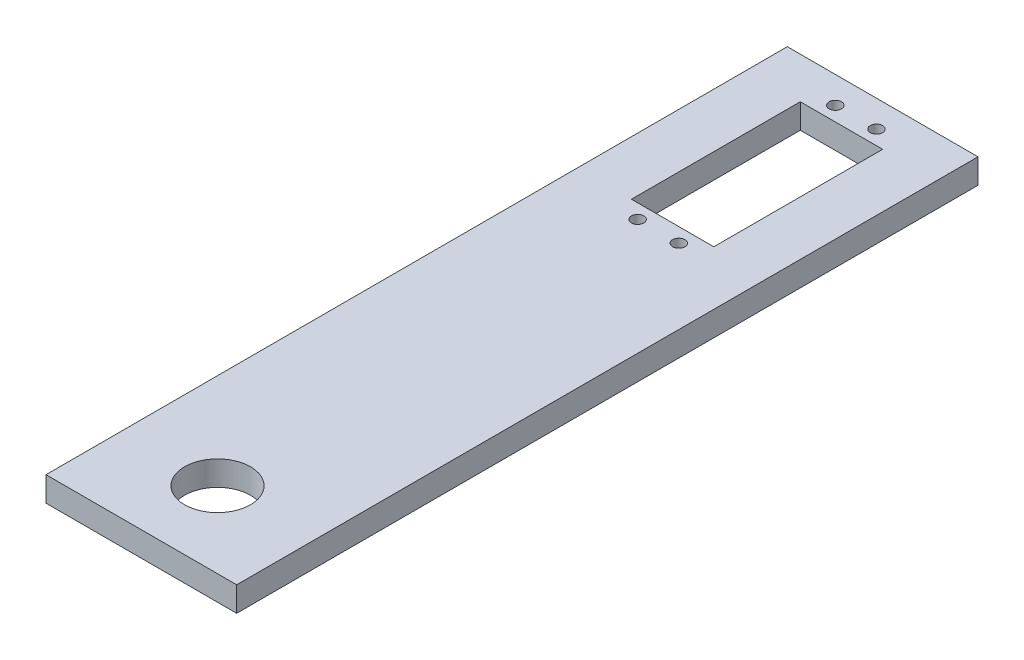
from build123d import *

# Parameters (mm, degrees)
SKETCH1_W           = 46.3
SKETCH1_H           = 180
BOSS_EXTRUDE1_DEPTH = 6
CUT_EXTRUDE1_REACH  = 187.956
SKETCH2_R           = 8
CUT_EXTRUDE2_REACH  = 187.956
SKETCH4_R           = 1.5
SKETCH4_W           = 20
SKETCH4_H           = 41


with BuildPart() as part:
    # Sketch1 → Boss-Extrude1 (new body)
    with BuildSketch(Plane(origin=(0, 0, 0), x_dir=(1, 0, 0), z_dir=(0, 1, 0))):
        with Locations((23.15, 90)):
            Rectangle(SKETCH1_W, SKETCH1_H)
    extrude(amount=BOSS_EXTRUDE1_DEPTH)

    # Sketch2 → Cut-Extrude1 (cut, up to next)
    with BuildSketch(Plane(origin=(0, 6, 0), x_dir=(1, 0, 0), z_dir=(0, 1, 0)), mode=Mode.PRIVATE) as cut_extrude1_sk1:
        with Locations(Location((23.15, 18.5, 0), (0, 0, 270))):
            Circle(SKETCH2_R)
    cut_extrude1_tool1 = extrude(cut_extrude1_sk1.sketch, amount=-CUT_EXTRUDE1_REACH, mode=Mode.PRIVATE) & part.part
    add(cut_extrude1_tool1.solids().sort_by_distance((23.15, 6, -18.5))[0], mode=Mode.SUBTRACT)

    # Sketch4 → Cut-Extrude2 (cut, up to next)
    with BuildSketch(Plane.XZ, mode=Mode.PRIVATE) as cut_extrude2_sk1:
        with Locations(Location((28.15, -173.5, 0), (0, 0, 270))):
            Circle(SKETCH4_R)
    cut_extrude2_tool1 = extrude(cut_extrude2_sk1.sketch, amount=-CUT_EXTRUDE2_REACH, mode=Mode.PRIVATE) & part.part
    # Sketch4 → Cut-Extrude2 (cut, up to next)
    with BuildSketch(Plane.XZ, mode=Mode.PRIVATE) as cut_extrude2_sk2:
        with Locations(Location((18.15, -173.5, 0), (0, 0, 270))):
            Circle(SKETCH4_R)
    cut_extrude2_tool2 = extrude(cut_extrude2_sk2.sketch, amount=-CUT_EXTRUDE2_REACH, mode=Mode.PRIVATE) & part.part
    # Sketch4 → Cut-Extrude2 (cut, up to next)
    with BuildSketch(Plane.XZ, mode=Mode.PRIVATE) as cut_extrude2_sk3:
        with Locations(Location((18.15, -125.5, 0), (0, 0, 270))):
            Circle(SKETCH4_R)
    cut_extrude2_tool3 = extrude(cut_extrude2_sk3.sketch, amount=-CUT_EXTRUDE2_REACH, mode=Mode.PRIVATE) & part.part
    # Sketch4 → Cut-Extrude2 (cut, up to next)
    with BuildSketch(Plane.XZ, mode=Mode.PRIVATE) as cut_extrude2_sk4:
        with Locations(Location((28.15, -125.5, 0), (0, 0, 270))):
            Circle(SKETCH4_R)
    cut_extrude2_tool4 = extrude(cut_extrude2_sk4.sketch, amount=-CUT_EXTRUDE2_REACH, mode=Mode.PRIVATE) & part.part
    # Sketch4 → Cut-Extrude2 (cut, up to next)
    with BuildSketch(Plane.XZ, mode=Mode.PRIVATE) as cut_extrude2_sk5:
        with Locations((23.15, -149.5)):
            Rectangle(SKETCH4_W, SKETCH4_H)
    cut_extrude2_tool5 = extrude(cut_extrude2_sk5.sketch, amount=-CUT_EXTRUDE2_REACH, mode=Mode.PRIVATE) & part.part
    add(cut_extrude2_tool1.solids().sort_by_distance((28.15, 0, -173.5))[0], mode=Mode.SUBTRACT)
    add(cut_extrude2_tool2.solids().sort_by_distance((18.15, 0, -173.5))[0], mode=Mode.SUBTRACT)
    add(cut_extrude2_tool3.solids().sort_by_distance((18.15, 0, -125.5))[0], mode=Mode.SUBTRACT)
    add(cut_extrude2_tool4.solids().sort_by_distance((28.15, 0, -125.5))[0], mode=Mode.SUBTRACT)
    add(cut_extrude2_tool5.solids().sort_by_distance((23.15, 0, -149.5))[0], mode=Mode.SUBTRACT)


solid = part.part
